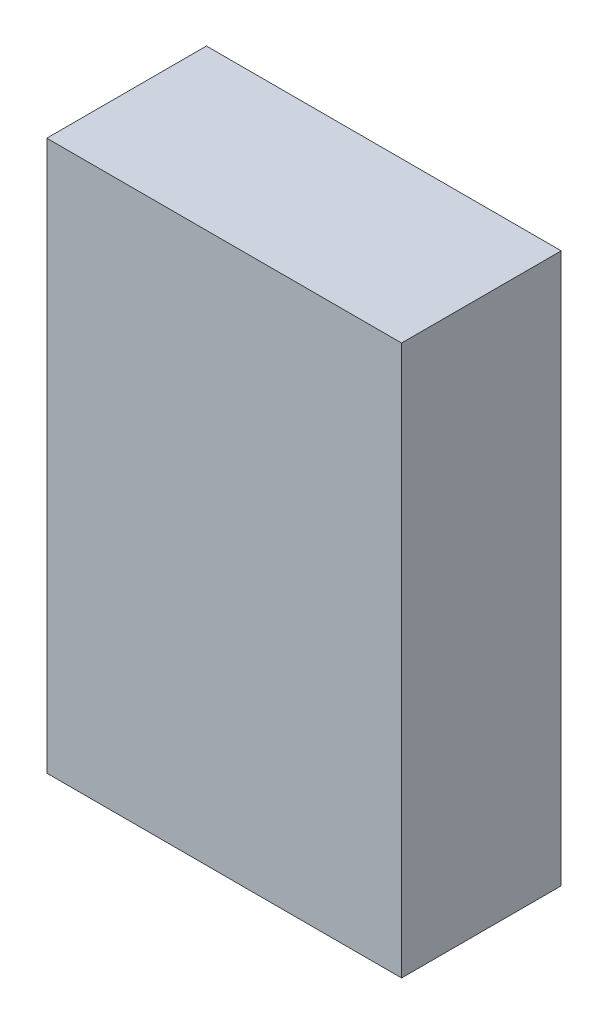
from build123d import *

# Parameters (mm, degrees)
ESQUISSE1_W      = 20
ESQUISSE1_H      = 31
EXTRUSION1_DEPTH = 9


with BuildPart() as part:
    # Esquisse1 → Extrusion1 (new body)
    with BuildSketch(Plane.XY):
        with Locations((-18.082097902, 21.590512821)):
            Rectangle(ESQUISSE1_W, ESQUISSE1_H)
    extrude(amount=EXTRUSION1_DEPTH)


solid = part.part
